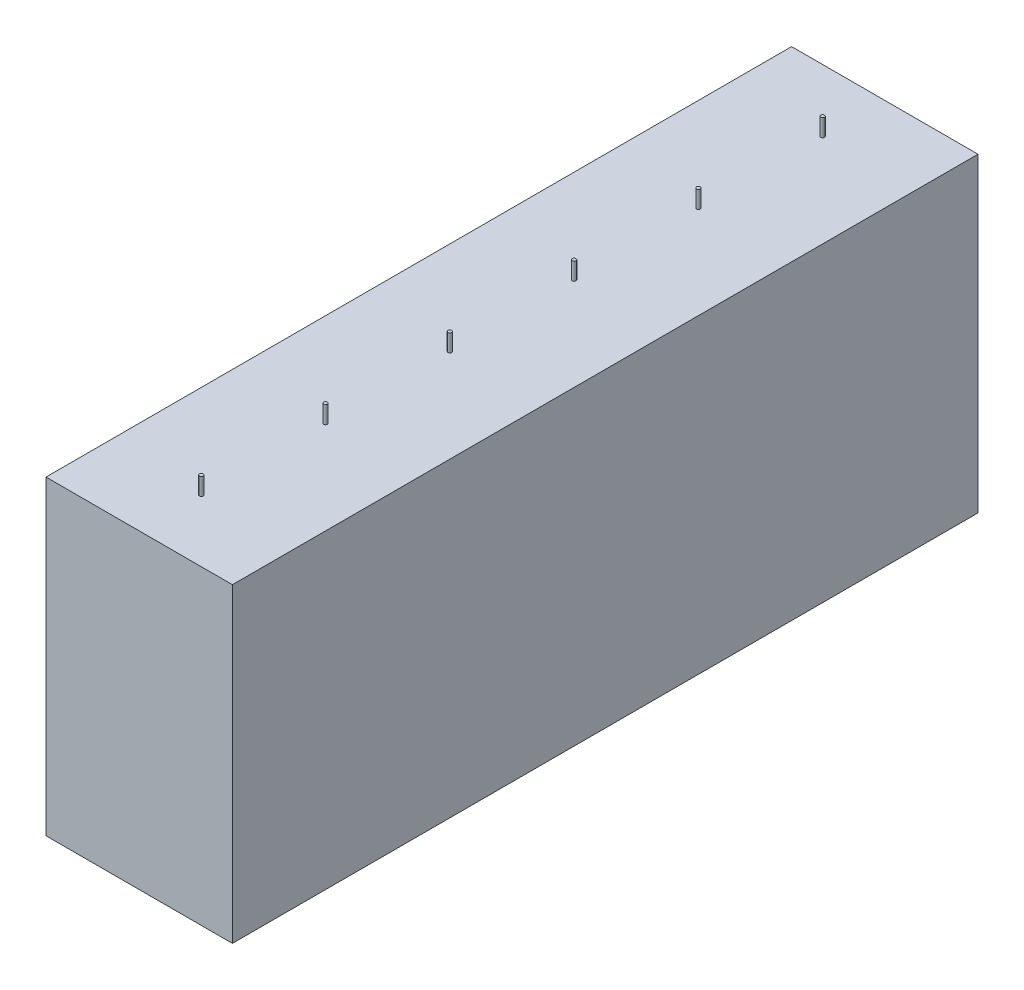
from build123d import *

# Parameters (mm, degrees)
SKETCH1_W           = 300
SKETCH1_H           = 500
BOSS_EXTRUDE1_DEPTH = 1200
SKETCH2_R           = 3
BOSS_EXTRUDE2_DEPTH = 28


with BuildPart() as part:
    # Sketch1 → Boss-Extrude1 (new body)
    with BuildSketch(Plane.XY):
        with Locations((66.901408451, -71.830985915)):
            Rectangle(SKETCH1_W, SKETCH1_H)
    extrude(amount=BOSS_EXTRUDE1_DEPTH)

    # Sketch2 → Boss-Extrude2 (add)
    with BuildSketch(Plane(origin=(0, 178.169014085, 0), x_dir=(1, 0, 0), z_dir=(0, 1, 0))):
        with Locations(Location((66.901408451, -100, 0), (0, 0, 90))):
            Circle(SKETCH2_R)
        with Locations(Location((66.901408451, -300, 0), (0, 0, 90))):
            Circle(SKETCH2_R)
        with Locations(Location((66.901408451, -500, 0), (0, 0, 90))):
            Circle(SKETCH2_R)
        with Locations(Location((66.901408451, -700, 0), (0, 0, 90))):
            Circle(SKETCH2_R)
        with Locations(Location((66.901408451, -900, 0), (0, 0, 90))):
            Circle(SKETCH2_R)
        with Locations(Location((66.901408451, -1100, 0), (0, 0, 90))):
            Circle(SKETCH2_R)
    extrude(amount=BOSS_EXTRUDE2_DEPTH)


solid = part.part
